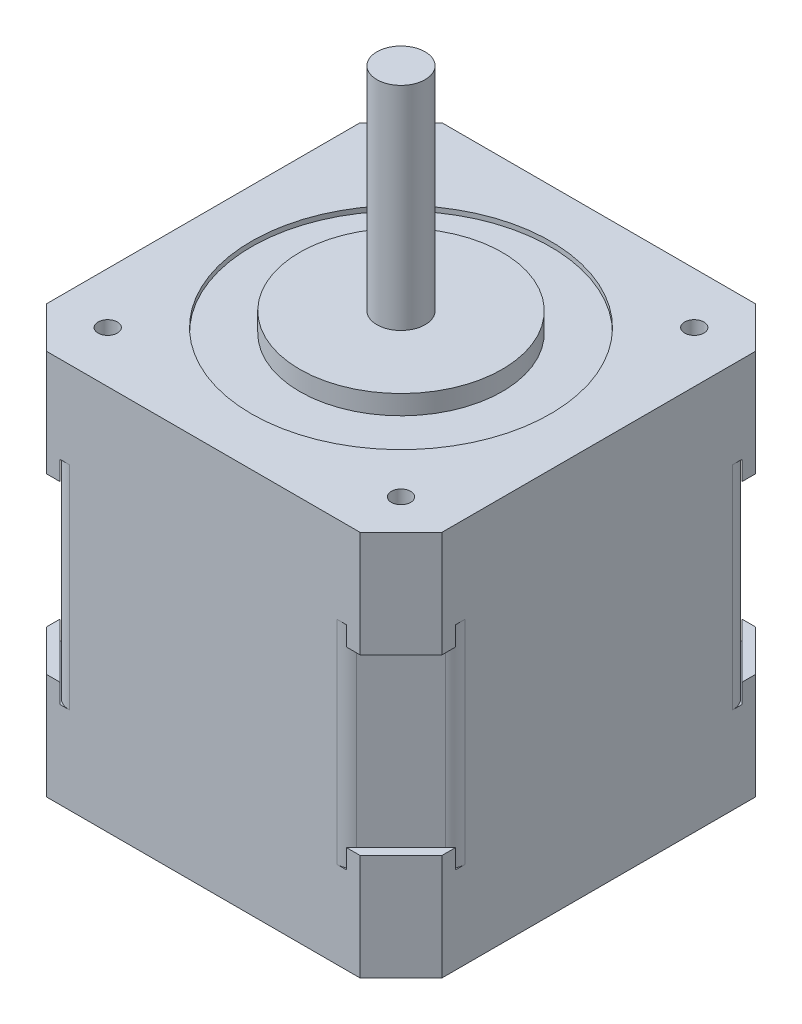
from build123d import *

# Parameters (mm, degrees)
BOSS_EXTRUDE1_DEPTH  = 9
BOSS_EXTRUDE2_DEPTH  = 2
BOSS_EXTRUDE3_DEPTH  = 11
FILLET1_R            = 2
FILLET1_OF_MIRROR3_R = 2
SKETCH4_R            = 15.5
CUT_EXTRUDE1_DEPTH   = 0.5
SKETCH6_R            = 10.5
BOSS_EXTRUDE4_DEPTH  = 2
SKETCH7_R            = 2.5
BOSS_EXTRUDE5_DEPTH  = 22
SKETCH8_R            = 1
CUT_EXTRUDE2_DEPTH   = 10


with BuildPart() as part:
    # Sketch1 → Boss-Extrude1 (new body)
    with BuildSketch(Plane(origin=(0, 0, 0), x_dir=(1, 0, 0), z_dir=(0, 1, 0))):
        Polygon((-20.5, -16.257359313), (-16.257359313, -20.5), (16.257359313, -20.5), (20.5, -16.257359313), (20.5, 16.257359313), (16.257359313, 20.5), (-16.257359313, 20.5), (-20.5, 16.257359313), align=None)
    boss_extrude1 = extrude(amount=BOSS_EXTRUDE1_DEPTH)

    # Sketch2 → Boss-Extrude2 (add)
    with BuildSketch(Plane(origin=(0, 9, 0), x_dir=(1, 0, 0), z_dir=(0, 1, 0))):
        Polygon((-20.5, -14.843145751), (-14.843145751, -20.5), (-16.257359313, -20.5), (-20.5, -16.257359313), align=None)
        Polygon((14.843145751, 20.5), (20.5, 14.843145751), (20.5, 16.257359313), (16.257359313, 20.5), align=None)
        Polygon((-20.5, 14.843145751), (-14.843145751, 20.5), (-16.257359313, 20.5), (-20.5, 16.257359313), align=None)
        Polygon((14.843145751, -20.5), (20.5, -14.843145751), (20.5, -16.257359313), (16.257359313, -20.5), align=None)
    boss_extrude2 = extrude(amount=BOSS_EXTRUDE2_DEPTH)

    # Sketch3 → Boss-Extrude3 (add)
    with BuildSketch(Plane(origin=(0, 9, 0), x_dir=(1, 0, 0), z_dir=(0, 1, 0))):
        Polygon((-14.701724394, -20.5), (-20.5, -14.701724394), (-20.5, 14.701724394), (-14.701724394, 20.5), (14.701724394, 20.5), (20.5, 14.701724394), (20.5, -14.701724394), (14.701724394, -20.5), align=None)
    boss_extrude3 = extrude(amount=BOSS_EXTRUDE3_DEPTH)

    # Fillet1
    fillet1_edges = [part.edges().sort_by_distance(p)[0] for p in [
        (-14.701724394, 14.5, 20.5),
        (14.701724394, 14.5, 20.5),
        (20.5, 14.5, 14.701724394),
        (20.5, 14.5, -14.701724394),
        (14.701724394, 14.5, -20.5),
        (-14.701724394, 14.5, -20.5),
        (-20.5, 14.5, -14.701724394),
        (-20.5, 14.5, 14.701724394),
    ]]
    fillet(fillet1_edges, radius=FILLET1_R)

    # Mirror3: Boss-Extrude1, Boss-Extrude2, Boss-Extrude3 across Plane1
    add(boss_extrude1.mirror(Plane(origin=(0, 20, 0), x_dir=(1, 0, 0), z_dir=(0, 1, 0))))
    add(boss_extrude2.mirror(Plane(origin=(0, 20, 0), x_dir=(1, 0, 0), z_dir=(0, 1, 0))))
    add(boss_extrude3.mirror(Plane(origin=(0, 20, 0), x_dir=(1, 0, 0), z_dir=(0, 1, 0))))

    # Fillet1 of Mirror3
    fillet1_of_mirror3_edges = [part.edges().sort_by_distance(p)[0] for p in [
        (-14.701724394, 25.5, 20.5),
        (14.701724394, 25.5, 20.5),
        (20.5, 25.5, 14.701724394),
        (20.5, 25.5, -14.701724394),
        (14.701724394, 25.5, -20.5),
        (-14.701724394, 25.5, -20.5),
        (-20.5, 25.5, -14.701724394),
        (-20.5, 25.5, 14.701724394),
    ]]
    fillet(fillet1_of_mirror3_edges, radius=FILLET1_OF_MIRROR3_R)

    # Sketch4 → Cut-Extrude1 (cut)
    with BuildSketch(Plane(origin=(0, 40, 0), x_dir=(1, 0, 0), z_dir=(0, 1, 0))):
        with Locations(Location((0, 0, 0), (0, 0, 270))):
            Circle(SKETCH4_R)
    extrude(amount=-CUT_EXTRUDE1_DEPTH, mode=Mode.SUBTRACT)

    # Sketch6 → Boss-Extrude4 (add)
    with BuildSketch(Plane(origin=(0, 39.5, 0), x_dir=(1, 0, 0), z_dir=(0, 1, 0))):
        with Locations(Location((0, 0, 0), (0, 0, 270))):
            Circle(SKETCH6_R)
    extrude(amount=BOSS_EXTRUDE4_DEPTH)

    # Sketch7 → Boss-Extrude5 (add)
    with BuildSketch(Plane(origin=(0, 41.5, 0), x_dir=(1, 0, 0), z_dir=(0, 1, 0))):
        with Locations(Location((0, 0, 0), (0, 0, 270))):
            Circle(SKETCH7_R)
    extrude(amount=BOSS_EXTRUDE5_DEPTH)

    # Sketch8 → Cut-Extrude2 (cut)
    with BuildSketch(Plane(origin=(0, 40, 0), x_dir=(1, 0, 0), z_dir=(0, 1, 0))):
        with Locations(Location((15.196699141, 15.196699141, 0), (0, 0, 270))):
            Circle(SKETCH8_R)
        with Locations(Location((15.196699141, -15.196699141, 0), (0, 0, 270))):
            Circle(SKETCH8_R)
        with Locations(Location((-15.196699141, -15.196699141, 0), (0, 0, 270))):
            Circle(SKETCH8_R)
        with Locations(Location((-15.196699141, 15.196699141, 0), (0, 0, 270))):
            Circle(SKETCH8_R)
    extrude(amount=-CUT_EXTRUDE2_DEPTH, mode=Mode.SUBTRACT)


solid = part.part
